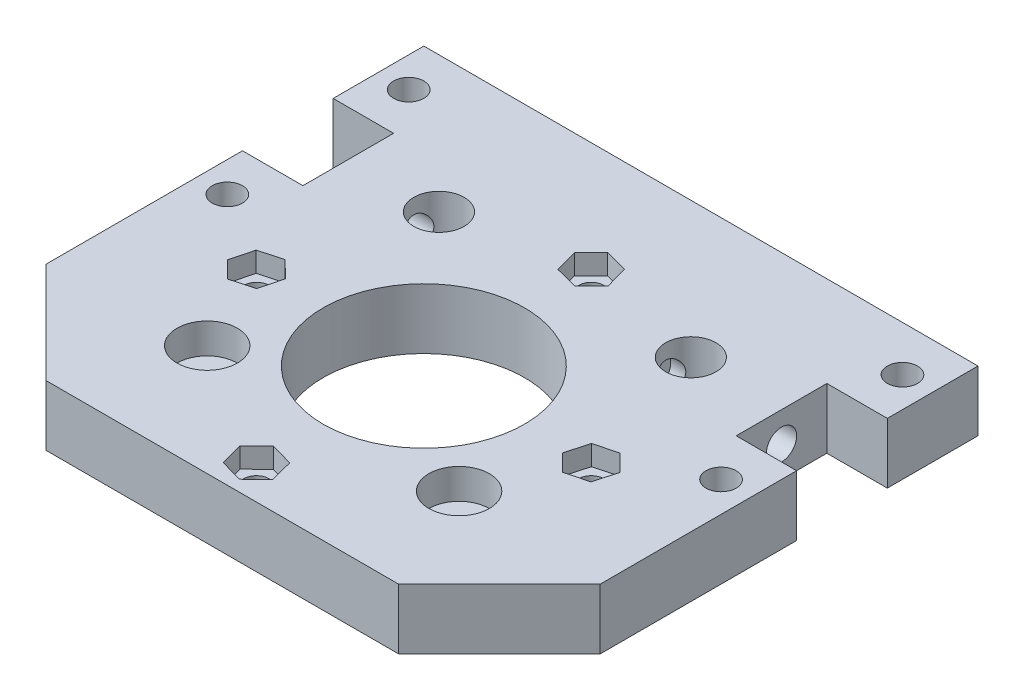
from build123d import *

# Parameters (mm, degrees)
SKETCH1_W           = 66
SKETCH1_H           = 95
SKETCH1_R           = 20
BOSS_EXTRUDE1_DEPTH = 12
BOSS_EXTRUDE3_DEPTH = 12
SKETCH6_R           = 6
CUT_EXTRUDE2_DEPTH  = 6
CHAMFER1_SIZE       = 20
CUT_EXTRUDE3_REACH  = 91.828
SKETCH7_R           = 3
SKETCH7_R_2         = 5
SKETCH9_R           = 3
CUT_EXTRUDE5_DEPTH  = 25
CUT_EXTRUDE6_REACH  = 91.828
SKETCH10_R          = 2.5
CUT_EXTRUDE7_DEPTH  = 4


with BuildPart() as part:
    # Sketch1 → Boss-Extrude1 (new body)
    with BuildSketch(Plane(origin=(0, 0, 0), x_dir=(1, 0, 0), z_dir=(0, 1, 0))):
        with Locations((0, -22.5)):
            Rectangle(SKETCH1_W, SKETCH1_H)
        with Locations(Location((0, -30, 0), (0, 0, 270))):
            Circle(SKETCH1_R, mode=Mode.SUBTRACT)
    extrude(amount=BOSS_EXTRUDE1_DEPTH)

    # Sketch3 → Boss-Extrude3 (add)
    with BuildSketch(Plane(origin=(0, 12, 0), x_dir=(1, 0, 0), z_dir=(0, 1, 0))):
        Polygon((55, 7), (43, 7), (43, -11), (55, -11), (55, -70), (33, -70), (33, 25), (55, 25), align=None)
    boss_extrude3 = extrude(amount=-BOSS_EXTRUDE3_DEPTH)

    # Mirror1: Boss-Extrude3 across plane
    add(boss_extrude3.mirror(Plane(origin=(0, 0, 0), x_dir=(0, 0, 1), z_dir=(1, 0, 0))))

    # Sketch6 → Cut-Extrude2 (cut)
    with BuildSketch(Plane(origin=(0, 12, 0), x_dir=(1, 0, 0), z_dir=(0, 1, 0))):
        with Locations(Location((-25, -48, 0), (0, 0, 270))):
            Circle(SKETCH6_R)
        with Locations(Location((25, -48, 0), (0, 0, 270))):
            Circle(SKETCH6_R)
    extrude(amount=-CUT_EXTRUDE2_DEPTH, mode=Mode.SUBTRACT)

    # Chamfer1
    chamfer1_edges = [part.edges().sort_by_distance(p)[0] for p in [
        (55, 6, 70),
        (-55, 6, 70),
    ]]
    chamfer(chamfer1_edges, length=CHAMFER1_SIZE)

    # Sketch7 → Cut-Extrude3 (cut, up to next)
    with BuildSketch(Plane(origin=(0, 12, 0), x_dir=(1, 0, 0), z_dir=(0, 1, 0)), mode=Mode.PRIVATE) as cut_extrude3_sk1:
        with Locations(Location((-49, 16, 0), (0, 0, 270))):
            Circle(SKETCH7_R)
    cut_extrude3_tool1 = extrude(cut_extrude3_sk1.sketch, amount=-CUT_EXTRUDE3_REACH, mode=Mode.PRIVATE) & part.part
    # Sketch7 → Cut-Extrude3 (cut, up to next)
    with BuildSketch(Plane(origin=(0, 12, 0), x_dir=(1, 0, 0), z_dir=(0, 1, 0)), mode=Mode.PRIVATE) as cut_extrude3_sk2:
        with Locations(Location((-49, -20, 0), (0, 0, 270))):
            Circle(SKETCH7_R)
    cut_extrude3_tool2 = extrude(cut_extrude3_sk2.sketch, amount=-CUT_EXTRUDE3_REACH, mode=Mode.PRIVATE) & part.part
    # Sketch7 → Cut-Extrude3 (cut, up to next)
    with BuildSketch(Plane(origin=(0, 12, 0), x_dir=(1, 0, 0), z_dir=(0, 1, 0)), mode=Mode.PRIVATE) as cut_extrude3_sk3:
        with Locations(Location((-25, -2, 0), (0, 0, 270))):
            Circle(SKETCH7_R_2)
    cut_extrude3_tool3 = extrude(cut_extrude3_sk3.sketch, amount=-CUT_EXTRUDE3_REACH, mode=Mode.PRIVATE) & part.part
    cut_extrude3_1 = cut_extrude3_tool1.solids().sort_by_distance((-49, 12, -16))[0]
    add(cut_extrude3_1, mode=Mode.SUBTRACT)
    cut_extrude3_2 = cut_extrude3_tool2.solids().sort_by_distance((-49, 12, 20))[0]
    add(cut_extrude3_2, mode=Mode.SUBTRACT)
    cut_extrude3_3 = cut_extrude3_tool3.solids().sort_by_distance((-25, 12, 2))[0]
    add(cut_extrude3_3, mode=Mode.SUBTRACT)
    cut_extrude3 = cut_extrude3_1 + cut_extrude3_2 + cut_extrude3_3  # Cut-Extrude3 as one shape, for the pattern or mirror that repeats it

    # Sketch9 → Cut-Extrude5 (cut)
    with BuildSketch(Plane.ZY.offset(43)):
        with Locations((2, 6)):
            Circle(SKETCH9_R)
    cut_extrude5 = extrude(amount=-CUT_EXTRUDE5_DEPTH, mode=Mode.SUBTRACT)

    # Mirror2: Cut-Extrude3, Cut-Extrude5 across plane
    add(cut_extrude3.mirror(Plane(origin=(0, 0, 0), x_dir=(0, 0, 1), z_dir=(1, 0, 0))), mode=Mode.SUBTRACT)
    add(cut_extrude5.mirror(Plane(origin=(0, 0, 0), x_dir=(0, 0, 1), z_dir=(1, 0, 0))), mode=Mode.SUBTRACT)

    # Sketch10 → Cut-Extrude6 (cut, up to next)
    with BuildSketch(Plane.XZ, mode=Mode.PRIVATE) as cut_extrude6_sk1:
        with Locations(Location((0, 63.234018716, 0), (0, 0, 270))):
            Circle(SKETCH10_R)
    cut_extrude6_tool1 = extrude(cut_extrude6_sk1.sketch, amount=-CUT_EXTRUDE6_REACH, mode=Mode.PRIVATE) & part.part
    # Sketch10 → Cut-Extrude6 (cut, up to next)
    with BuildSketch(Plane.XZ, mode=Mode.PRIVATE) as cut_extrude6_sk2:
        with Locations(Location((-33.234018716, 30, 0), (0, 0, 270))):
            Circle(SKETCH10_R)
    cut_extrude6_tool2 = extrude(cut_extrude6_sk2.sketch, amount=-CUT_EXTRUDE6_REACH, mode=Mode.PRIVATE) & part.part
    # Sketch10 → Cut-Extrude6 (cut, up to next)
    with BuildSketch(Plane.XZ, mode=Mode.PRIVATE) as cut_extrude6_sk3:
        with Locations(Location((0, -3.234018716, 0), (0, 0, 270))):
            Circle(SKETCH10_R)
    cut_extrude6_tool3 = extrude(cut_extrude6_sk3.sketch, amount=-CUT_EXTRUDE6_REACH, mode=Mode.PRIVATE) & part.part
    # Sketch10 → Cut-Extrude6 (cut, up to next)
    with BuildSketch(Plane.XZ, mode=Mode.PRIVATE) as cut_extrude6_sk4:
        with Locations(Location((33.234018716, 30, 0), (0, 0, 270))):
            Circle(SKETCH10_R)
    cut_extrude6_tool4 = extrude(cut_extrude6_sk4.sketch, amount=-CUT_EXTRUDE6_REACH, mode=Mode.PRIVATE) & part.part
    add(cut_extrude6_tool1.solids().sort_by_distance((0, 0, 63.234019))[0], mode=Mode.SUBTRACT)
    add(cut_extrude6_tool2.solids().sort_by_distance((-33.234019, 0, 30))[0], mode=Mode.SUBTRACT)
    add(cut_extrude6_tool3.solids().sort_by_distance((0, 0, -3.234019))[0], mode=Mode.SUBTRACT)
    add(cut_extrude6_tool4.solids().sort_by_distance((33.234019, 0, 30))[0], mode=Mode.SUBTRACT)

    # Sketch12 → Cut-Extrude7 (cut)
    with BuildSketch(Plane(origin=(0, 12, 0), x_dir=(1, 0, 0), z_dir=(0, 1, 0))):
        Polygon((3.334261142, -59.954887332), (-1.17268051, -58.706898172), (-4.506941652, -61.986029556), (-3.334261142, -66.5131501), (1.17268051, -67.76113926), (4.506941652, -64.482007876), align=None)
        Polygon((-29.899757573, -33.279131384), (-28.727077064, -28.75201084), (-32.061338206, -25.472879456), (-36.568279858, -26.720868616), (-37.740960368, -31.24798916), (-34.406699225, -34.527120544), align=None)
        Polygon((-3.282764492, -0.096665492), (1.24307489, -1.274280833), (4.525839382, 2.056403375), (3.282764492, 6.564702924), (-1.24307489, 7.742318264), (-4.525839382, 4.411634056), align=None)
        Polygon((29.951254224, -26.669315792), (28.708179334, -31.177615341), (31.990943826, -34.508299548), (36.516783208, -33.330684208), (37.759858098, -28.822384659), (34.477093606, -25.491700452), align=None)
    extrude(amount=-CUT_EXTRUDE7_DEPTH, mode=Mode.SUBTRACT)


solid = part.part
